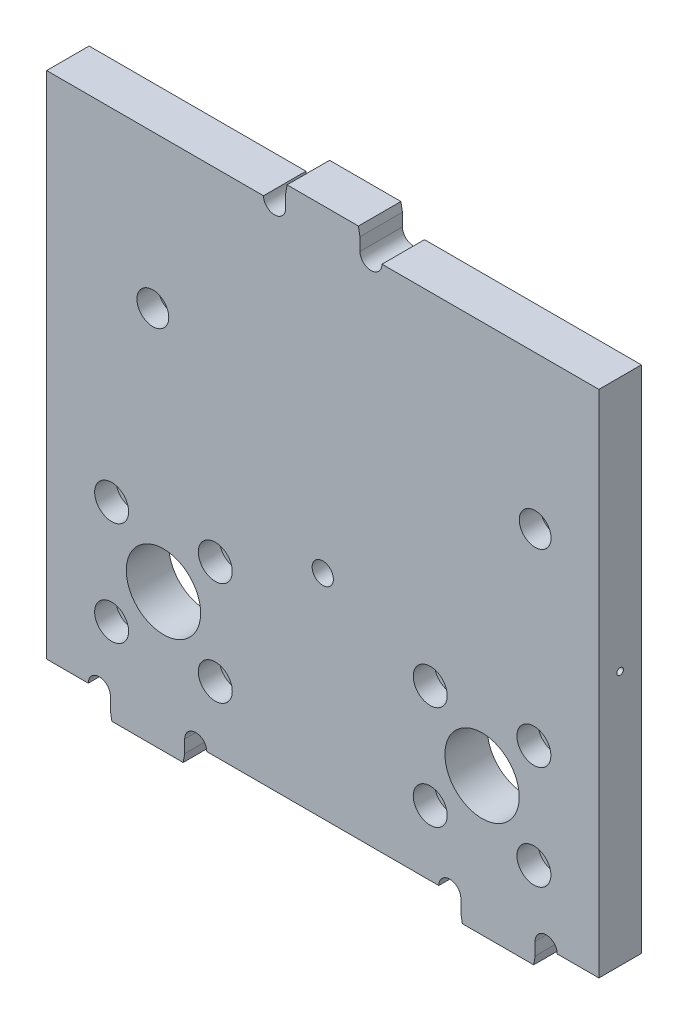
from build123d import *

# Parameters (mm, degrees)
SKETCH1_W             = 165.1
SKETCH1_H             = 152.4
BOSS_EXTRUDE1_DEPTH   = 12.7
BOSS_EXTRUDE2_DEPTH   = 12.7
CUT_EXTRUDE1_REACH    = 119.432
BOSS_EXTRUDE3_DEPTH   = 12.7
CUT_EXTRUDE2_DEPTH    = 12.7
SKETCH7_R             = 11.1125
CUT_EXTRUDE3_DEPTH    = 12.7
M3_CLEARANCE_HOLE1_D  = 3.4
SKETCH14_R            = 4.7625
CUT_EXTRUDE5_DEPTH    = 6.35
SKETCH13_R            = 3.175
CUT_EXTRUDE7_DEPTH    = 6.35
F_8_CLEARANCE_HOLE1_D = 4.4958
SKETCH18_R            = 5.08
CUT_EXTRUDE8_DEPTH    = 6.35
SKETCH20_R            = 0.99187
CUT_EXTRUDE9_DEPTH    = 25.4


with BuildPart() as part:
    # Sketch1 → Boss-Extrude1 (new body)
    with BuildSketch(Plane.XY):
        Rectangle(SKETCH1_W, SKETCH1_H)
    extrude(amount=BOSS_EXTRUDE1_DEPTH)

    # Sketch2 → Boss-Extrude2 (add)
    with BuildSketch(Plane.XY.offset(12.7)):
        Polygon((-11.1125, 76.2), (11.1125, 76.2), (11.1125, 80.01), (10.664629469, 82.55), (-10.664629469, 82.55), (-11.1125, 80.01), align=None)
    extrude(amount=-BOSS_EXTRUDE2_DEPTH)

    # Sketch4 → Cut-Extrude1 (cut, up to next)
    with BuildSketch(Plane.XY.offset(12.7), mode=Mode.PRIVATE) as cut_extrude1_sk1:
        with BuildLine():
            Line((-17.7165, 76.2), (-11.1125, 76.2))
            ThreePointArc((-11.1125, 76.2), (-14.4145, 72.898), (-17.7165, 76.2))
        make_face()
    cut_extrude1_tool1 = extrude(cut_extrude1_sk1.sketch, amount=-CUT_EXTRUDE1_REACH, mode=Mode.PRIVATE) & part.part
    # Sketch4 → Cut-Extrude1 (cut, up to next)
    with BuildSketch(Plane.XY.offset(12.7), mode=Mode.PRIVATE) as cut_extrude1_sk2:
        with BuildLine():
            Line((11.1125, 76.2), (17.7165, 76.2))
            ThreePointArc((17.7165, 76.2), (14.4145, 72.898), (11.1125, 76.2))
        make_face()
    cut_extrude1_tool2 = extrude(cut_extrude1_sk2.sketch, amount=-CUT_EXTRUDE1_REACH, mode=Mode.PRIVATE) & part.part
    add(cut_extrude1_tool1.solids().sort_by_distance((-14.4145, 74.798588, 12.7))[0], mode=Mode.SUBTRACT)
    add(cut_extrude1_tool2.solids().sort_by_distance((14.4145, 74.798588, 12.7))[0], mode=Mode.SUBTRACT)

    # Sketch5 → Boss-Extrude3 (add)
    with BuildSketch(Plane.XY.offset(12.7)):
        Polygon((63.5, -76.2), (41.275, -76.2), (41.275, -80.01), (41.722870531, -82.55), (63.052129469, -82.55), (63.5, -80.01), align=None)
    boss_extrude3 = extrude(amount=-BOSS_EXTRUDE3_DEPTH)

    # Sketch6 → Cut-Extrude2 (cut)
    with BuildSketch(Plane.XY.offset(12.7)):
        with BuildLine():
            Line((34.671, -76.2), (41.275, -76.2))
            ThreePointArc((41.275, -76.2), (37.973, -72.898), (34.671, -76.2))
        make_face()
        with BuildLine():
            Line((63.5, -76.2), (70.104, -76.2))
            ThreePointArc((70.104, -76.2), (66.802, -72.898), (63.5, -76.2))
        make_face()
    cut_extrude2 = extrude(amount=-CUT_EXTRUDE2_DEPTH, mode=Mode.SUBTRACT)

    # Mirror1: Boss-Extrude3, Cut-Extrude2 across plane
    add(boss_extrude3.mirror(Plane(origin=(0, 0, 0), x_dir=(0, 0, 1), z_dir=(1, 0, 0))))
    add(cut_extrude2.mirror(Plane(origin=(0, 0, 0), x_dir=(0, 0, 1), z_dir=(1, 0, 0))), mode=Mode.SUBTRACT)

    # Sketch7 → Cut-Extrude3 (cut)
    with BuildSketch(Plane.XY.offset(12.7)):
        with Locations((-47.625, -41.275)):
            Circle(SKETCH7_R)
        with Locations((47.625, -41.275)):
            Circle(SKETCH7_R)
    extrude(amount=-CUT_EXTRUDE3_DEPTH, mode=Mode.SUBTRACT)

    # M3 Clearance Hole1 (through all)
    with Locations(Plane.XY.offset(12.7)):
        with Locations((-63.119, -25.781), (-32.131, -25.781), (-32.131, -56.769), (-63.119, -56.769)):
            m3_clearance_hole1 = Hole(M3_CLEARANCE_HOLE1_D / 2)

    # Mirror2: M3 Clearance Hole1 across plane
    add(m3_clearance_hole1.mirror(Plane(origin=(0, 0, 0), x_dir=(0, 0, 1), z_dir=(1, 0, 0))), mode=Mode.SUBTRACT)

    # Sketch14 → Cut-Extrude5 (cut)
    with BuildSketch(Plane.XY.offset(12.7)):
        with Locations((-50.8, 30.528732114)):
            Circle(SKETCH14_R)
        with Locations((63.5, 30.528732114)):
            Circle(SKETCH14_R)
    extrude(amount=-CUT_EXTRUDE5_DEPTH, mode=Mode.SUBTRACT)

    # Sketch13 → Cut-Extrude7 (cut)
    with BuildSketch(Plane.XY.offset(12.7)):
        with Locations((0, -12.655936751)):
            Circle(SKETCH13_R)
    extrude(amount=-CUT_EXTRUDE7_DEPTH, mode=Mode.SUBTRACT)

    # #8 Clearance Hole1 (through all)
    with Locations(Plane.XY.offset(12.7)):
        with Locations((0, -12.655936751), (63.5, 30.528732114), (-50.8, 30.528732114)):
            Hole(F_8_CLEARANCE_HOLE1_D / 2)

    # Sketch18 → Cut-Extrude8 (cut)
    with BuildSketch(Plane.XY.offset(12.7)):
        with Locations((-63.119, -25.781)):
            Circle(SKETCH18_R)
        with Locations(Location((-63.119, -56.769, 0), (0, 0, 180))):
            Circle(SKETCH18_R)
        with Locations((-32.131, -56.769)):
            Circle(SKETCH18_R)
        with Locations(Location((-32.131, -25.781, 0), (0, 0, 180))):
            Circle(SKETCH18_R)
        with Locations((32.131, -25.781)):
            Circle(SKETCH18_R)
        with Locations(Location((32.131, -56.769, 0), (0, 0, 180))):
            Circle(SKETCH18_R)
        with Locations((63.119, -56.769)):
            Circle(SKETCH18_R)
        with Locations(Location((63.119, -25.781, 0), (0, 0, 180))):
            Circle(SKETCH18_R)
    extrude(amount=-CUT_EXTRUDE8_DEPTH, mode=Mode.SUBTRACT)

    # Sketch20 → Cut-Extrude9 (cut)
    with BuildSketch(Plane(origin=(82.55, 0, 0), x_dir=(0, 0, -1), z_dir=(1, 0, 0))):
        with Locations((-6.35, 0)):
            Circle(SKETCH20_R)
    cut_extrude9 = extrude(amount=-CUT_EXTRUDE9_DEPTH, mode=Mode.SUBTRACT)

    # Mirror3: Cut-Extrude9 across plane
    add(cut_extrude9.mirror(Plane(origin=(0, 0, 0), x_dir=(0, 0, 1), z_dir=(1, 0, 0))), mode=Mode.SUBTRACT)


solid = part.part
